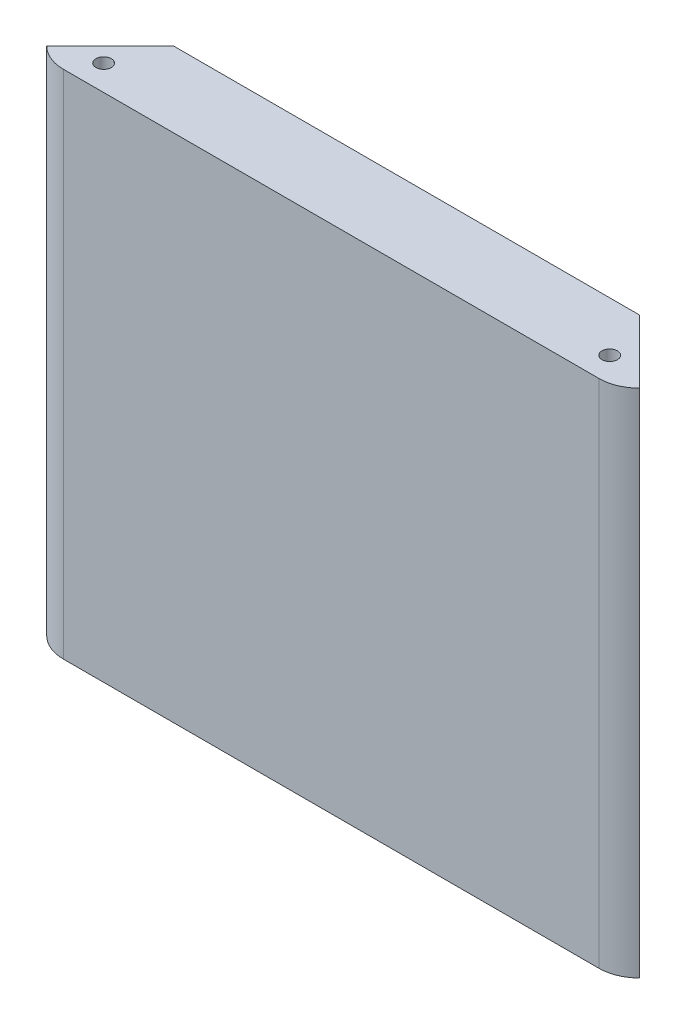
from build123d import *

# Parameters (mm, degrees)
SKETCH_1_W            = 81.9
SKETCH_1_H            = 67.9
EXTRUDE_1_DEPTH       = 10
SKETCH_2_W            = 60.5
SKETCH_2_H            = 60.5
CUT_EXTRUDE_1_DEPTH   = 8.5
CUT_EXTRUDE_4_REACH   = 91.242
M2_5X0_451_AT_2_COUNT = 2
M2_5X0_451_AT_2_PITCH = 67.264213562
CUT_EXTRUDE_5_REACH   = 81.921


with BuildPart() as part:
    # Эскиз1 → Бобышка-Вытянуть1 (new body)
    with BuildSketch(Plane.XY):
        Rectangle(SKETCH_1_W, SKETCH_1_H)
    extrude(amount=-EXTRUDE_1_DEPTH)

    # Эскиз2 → Вырез-Вытянуть1 (cut)
    with BuildSketch(Plane(origin=(0, 0, -10), x_dir=(-1, 0, 0), z_dir=(0, 0, -1))):
        Rectangle(SKETCH_2_W, SKETCH_2_H)
    extrude(amount=-CUT_EXTRUDE_1_DEPTH, mode=Mode.SUBTRACT)

    # Эскиз4 → Вырез-Вытянуть4 (cut, up to next)
    with BuildSketch(Plane(origin=(0, -33.95, -40.95), x_dir=(1, 0, 0), z_dir=(0, 1, 0)), mode=Mode.PRIVATE) as cut_extrude_4_sk1:
        with BuildLine():
            Line((39.383021279, -39.383021279), (40.95, -40.95))
            Line((40.95, -40.95), (35.6, -40.95))
            ThreePointArc((35.6, -40.95), (37.647356363, -40.542755499), (39.383021279, -39.383021279))
        make_face()
    cut_extrude_4_tool1 = extrude(cut_extrude_4_sk1.sketch, amount=CUT_EXTRUDE_4_REACH, mode=Mode.PRIVATE) & part.part
    # Эскиз4 → Вырез-Вытянуть4 (cut, up to next)
    with BuildSketch(Plane(origin=(0, -33.95, -40.95), x_dir=(1, 0, 0), z_dir=(0, 1, 0)), mode=Mode.PRIVATE) as cut_extrude_4_sk2:
        with BuildLine():
            Line((-40.95, -40.95), (-35.6, -40.95))
            ThreePointArc((-35.6, -40.95), (-37.647356363, -40.542755499), (-39.383021279, -39.383021279))
            Line((-39.383021279, -39.383021279), (-40.95, -40.95))
        make_face()
    cut_extrude_4_tool2 = extrude(cut_extrude_4_sk2.sketch, amount=CUT_EXTRUDE_4_REACH, mode=Mode.PRIVATE) & part.part
    add(cut_extrude_4_tool1.solids().sort_by_distance((39.042099, -33.95, -0.482136))[0], mode=Mode.SUBTRACT)
    add(cut_extrude_4_tool2.solids().sort_by_distance((-39.042099, -33.95, -0.482136))[0], mode=Mode.SUBTRACT)

    # Эскиз8 → Отверстие обработанное метчиком M2.5x0.451 (revolve, cut)
    with BuildSketch(Plane(origin=(33.632106781, 33.95, -3.382106781), x_dir=(0, 0, 1), z_dir=(1, 0, 0))):
        Polygon((0, 0), (0, 5.615882135), (1.025, 5), (1.025, 0), align=None)
    m2_5x0_451 = revolve(axis=Axis((33.632106781, 40.3, -3.382106781), (0, -1, 0)), mode=Mode.SUBTRACT)

    # Отверстие обработанное метчиком M2.5x0.451 at 2: Отверстие обработанное метчиком M2.5x0.451 ×2
    with Locations(*[(-i * M2_5X0_451_AT_2_PITCH, 0, 0) for i in range(1, M2_5X0_451_AT_2_COUNT)]):
        add(m2_5x0_451, mode=Mode.SUBTRACT)

    # Зеркальное отражение1: Отверстие обработанное метчиком M2.5x0.451 across plane
    add(m2_5x0_451.mirror(Plane.ZX), mode=Mode.SUBTRACT)

    # Зеркальное отражение1 copy 1 sketch → Зеркальное отражение1 copy 1 (revolve, cut)
    with BuildSketch(Plane(origin=(-33.632106781, -33.95, -3.382106781), x_dir=(0, 0, 1), z_dir=(1, 0, 0))):
        Polygon((0, 0), (0, -5.615882135), (1.025, -5), (1.025, 0), align=None)
    revolve(axis=Axis((-33.632106781, -40.3, -3.382106781), (0, -1, 0)), mode=Mode.SUBTRACT)

    # Эскиз3 → Вырез-Вытянуть5 (cut, up to next)
    with BuildSketch(Plane(origin=(0, 33.95, 0), x_dir=(1, 0, 0), z_dir=(0, 1, 0)), mode=Mode.PRIVATE) as cut_extrude_5_sk1:
        Polygon((30.95, 10), (40.95, 0), (40.95, 10), align=None)
    cut_extrude_5_tool1 = extrude(cut_extrude_5_sk1.sketch, amount=-CUT_EXTRUDE_5_REACH, mode=Mode.PRIVATE) & part.part
    # Эскиз3 → Вырез-Вытянуть5 (cut, up to next)
    with BuildSketch(Plane(origin=(0, 33.95, 0), x_dir=(1, 0, 0), z_dir=(0, 1, 0)), mode=Mode.PRIVATE) as cut_extrude_5_sk2:
        Polygon((-30.95, 10), (-40.95, 10), (-40.95, 0), align=None)
    cut_extrude_5_tool2 = extrude(cut_extrude_5_sk2.sketch, amount=-CUT_EXTRUDE_5_REACH, mode=Mode.PRIVATE) & part.part
    add(cut_extrude_5_tool1.solids().sort_by_distance((37.616667, 33.95, -6.666667))[0], mode=Mode.SUBTRACT)
    add(cut_extrude_5_tool2.solids().sort_by_distance((-37.616667, 33.95, -6.666667))[0], mode=Mode.SUBTRACT)


solid = part.part
